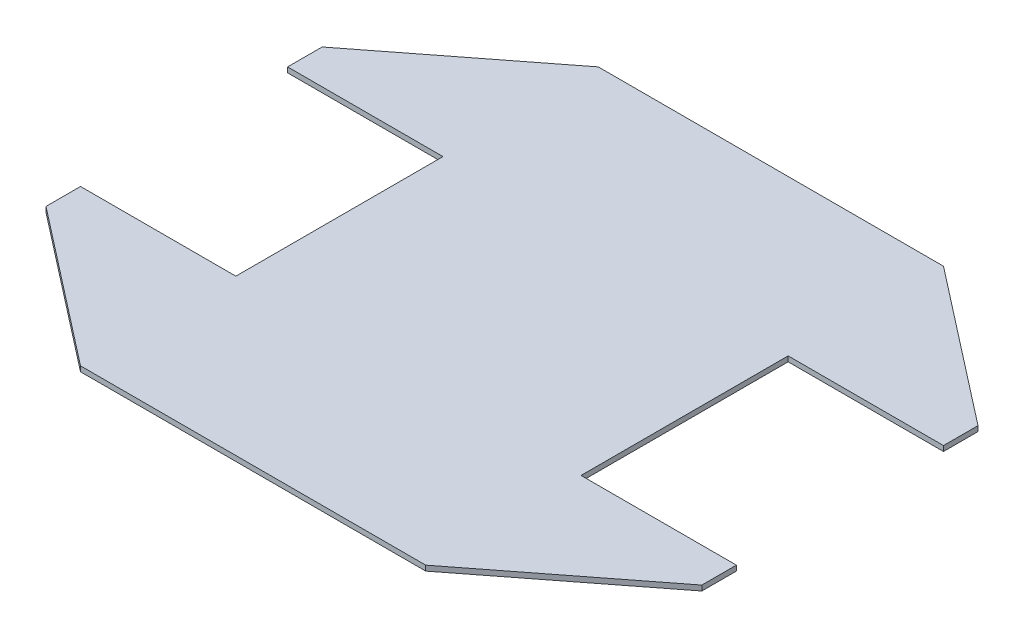
from build123d import *

# Parameters (mm, degrees)
BOSS_EXTRUDE1_DEPTH = 3


with BuildPart() as part:
    # Sketch1 → Boss-Extrude1 (new body)
    with BuildSketch(Plane(origin=(0, 0, 0), x_dir=(1, 0, 0), z_dir=(0, 1, 0))):
        Polygon((-100, 150), (100, 150), (190, 80), (190, 60), (100, 60), (100, -60), (190, -60), (190, -80), (100, -150), (-100, -150), (-190, -80), (-190, -60), (-100, -60), (-100, 60), (-190, 60), (-190, 80), align=None)
    extrude(amount=BOSS_EXTRUDE1_DEPTH)


solid = part.part
